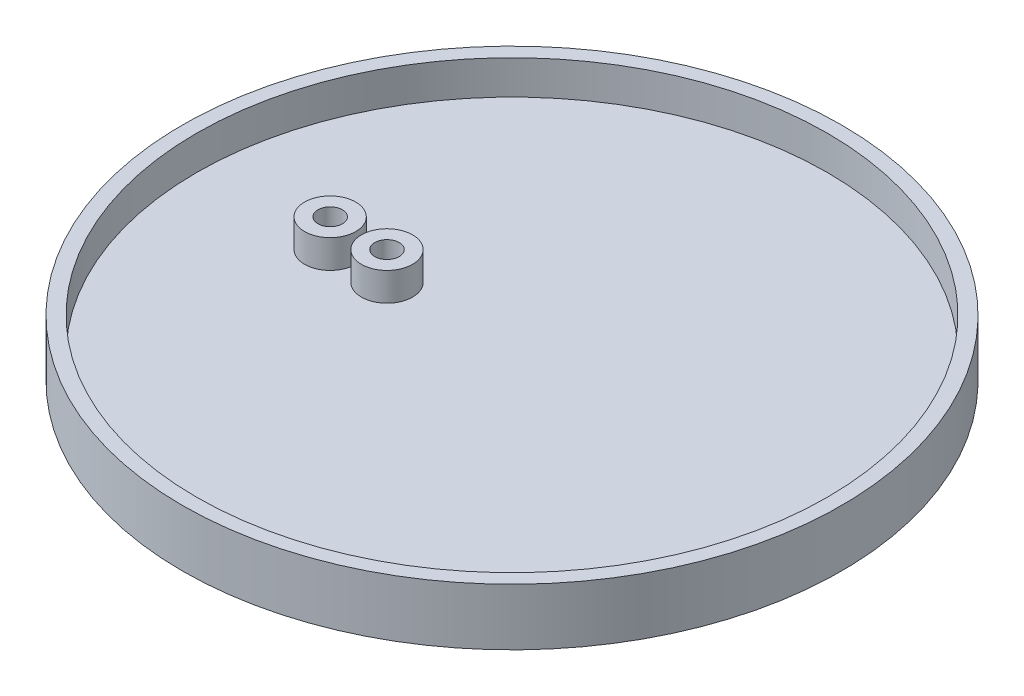
from build123d import *

# Parameters (mm, degrees)
SKETCH_1_R                       = 4.5
MOVING_POST_A_DEPTH              = 9
SKETCH_2_R                       = 58
CUP_PLATE_D116_T4_DEPTH          = 4
SKETCH_3_R                       = 4.5
MOVING_POST_B_DEPTH              = 9
SKETCH_4_R                       = 58
SKETCH_4_R_2                     = 55.5
DRIP_SKIRT_OD116_ID111_H10_DEPTH = 10
SKETCH_5_R                       = 2.15
M4_MOVING_MOUNT_CLEARANCE_DEPTH  = 9


with BuildPart() as part:
    # 草图1 → Moving_post_A (new body)
    with BuildSketch(Plane(origin=(0, 0, 0), x_dir=(1, 0, 0), z_dir=(0, 1, 0))):
        with Locations(Location((-22, 0, 0), (0, 0, 270))):
            Circle(SKETCH_1_R)
    extrude(amount=MOVING_POST_A_DEPTH)

    # 草图2 → Cup_plate_D116_T4 (add)
    with BuildSketch(Plane(origin=(0, 0, 0), x_dir=(1, 0, 0), z_dir=(0, 1, 0))):
        with Locations(Location((0, 0, 0), (0, 0, 270))):
            Circle(SKETCH_2_R)
    extrude(amount=CUP_PLATE_D116_T4_DEPTH)

    # 草图3 → Moving_post_B (add)
    with BuildSketch(Plane(origin=(0, 0, 0), x_dir=(1, 0, 0), z_dir=(0, 1, 0))):
        with Locations(Location((-32, 0, 0), (0, 0, 270))):
            Circle(SKETCH_3_R)
    extrude(amount=MOVING_POST_B_DEPTH)

    # 草图4 → Drip_skirt_OD116_ID111_H10 (add)
    with BuildSketch(Plane(origin=(0, 0, 0), x_dir=(1, 0, 0), z_dir=(0, 1, 0))):
        with Locations(Location((0, 0, 0), (0, 0, 270))):
            Circle(SKETCH_4_R)
        with Locations(Location((0, 0, 0), (0, 0, 270))):
            Circle(SKETCH_4_R_2, mode=Mode.SUBTRACT)
    extrude(amount=DRIP_SKIRT_OD116_ID111_H10_DEPTH)

    # 草图5 → M4_moving_mount_clearance (cut)
    with BuildSketch(Plane(origin=(0, 0, 0), x_dir=(1, 0, 0), z_dir=(0, 1, 0))):
        with Locations(Location((-22, 0, 0), (0, 0, 270))):
            Circle(SKETCH_5_R)
        with Locations(Location((-32, 0, 0), (0, 0, 270))):
            Circle(SKETCH_5_R)
    extrude(amount=M4_MOVING_MOUNT_CLEARANCE_DEPTH, mode=Mode.SUBTRACT)


solid = part.part
